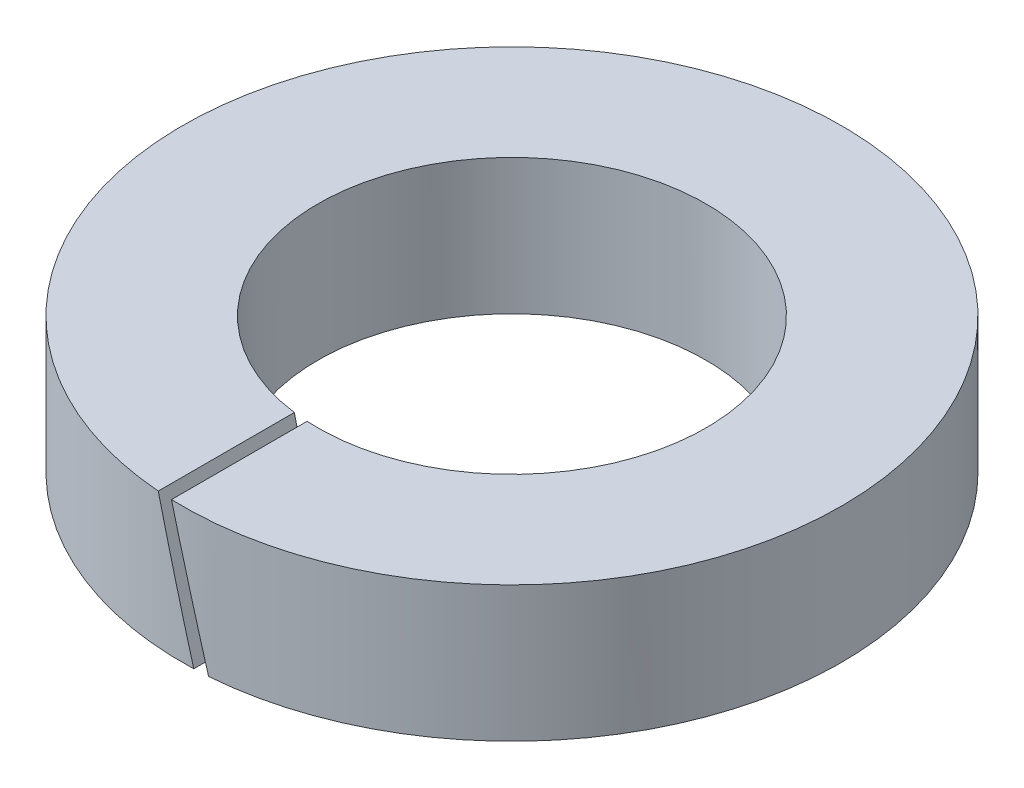
from build123d import *

# Parameters (mm, degrees)
ESQUISSE1_W = 1.5
ESQUISSE1_H = 1.5
FENTE_REACH = 10.298


with BuildPart() as part:
    # Esquisse1 → Base (revolve)
    with BuildSketch(Plane.XY):
        with Locations((2.9, 0.75)):
            Rectangle(ESQUISSE1_W, ESQUISSE1_H)
    revolve(axis=Axis((0, 0.5, 0), (0, -1, 0)))

    # Esquisse2 → Fente (cut, up to next)
    with BuildSketch(Plane.XY.offset(3.65), mode=Mode.PRIVATE) as fente_sk1:
        Polygon((-0.474368226, 2.230588572), (-0.072444437, 0.730588572), (0.329479352, -0.769411428), (0.474368226, -0.730588572), (0.072444437, 0.769411428), (-0.329479352, 2.269411428), align=None)
    fente_tool1 = extrude(fente_sk1.sketch, amount=-FENTE_REACH, mode=Mode.PRIVATE) & part.part
    add(fente_tool1.solids().sort_by_distance((0, 0.75, 3.65))[0], mode=Mode.SUBTRACT)


solid = part.part
